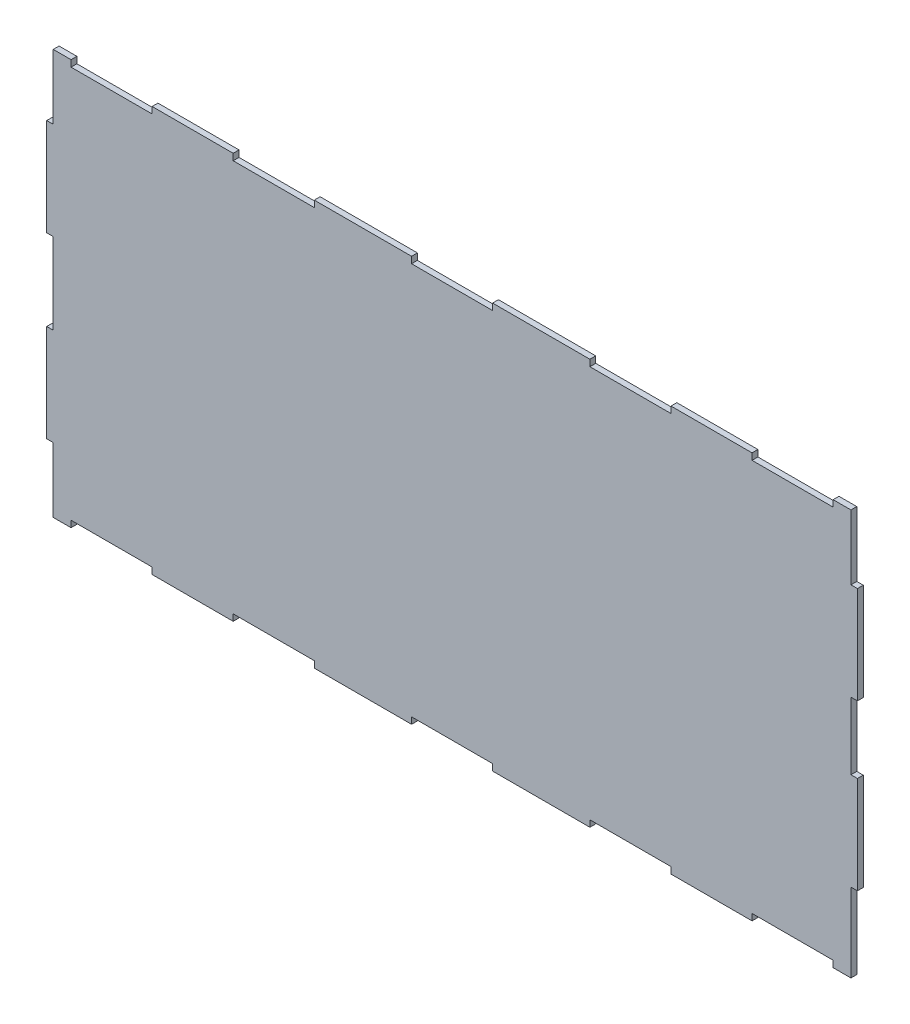
from build123d import *

# Parameters (mm, degrees)
SKETCH_1_W          = 500
SKETCH_1_H          = 250
EXTRUDE_1_DEPTH     = 3.6
SKETCH_2_W          = 50
SKETCH_2_H          = 4
CUT_EXTRUDE_1_DEPTH = 3.6
SKETCH_3_W          = 4
SKETCH_3_H          = 50
SKETCH_3_H_2        = 41.448480175
CUT_EXTRUDE_2_DEPTH = 3.6


with BuildPart() as part:
    # 草图1 → 凸台-拉伸1 (new body)
    with BuildSketch(Plane.XY):
        Rectangle(SKETCH_1_W, SKETCH_1_H)
    extrude(amount=EXTRUDE_1_DEPTH)

    # 草图2 → 切除-拉伸1 (cut)
    with BuildSketch(Plane.XY.offset(3.6)):
        with Locations((0, 123)):
            Rectangle(SKETCH_2_W, SKETCH_2_H)
        with Locations((-110, 123)):
            Rectangle(SKETCH_2_W, SKETCH_2_H)
        with Locations((-210, 123)):
            Rectangle(SKETCH_2_W, SKETCH_2_H)
        with Locations((110, 123)):
            Rectangle(SKETCH_2_W, SKETCH_2_H)
        with Locations((210, 123)):
            Rectangle(SKETCH_2_W, SKETCH_2_H)
        with Locations((210, -123)):
            Rectangle(SKETCH_2_W, SKETCH_2_H)
        with Locations((110, -123)):
            Rectangle(SKETCH_2_W, SKETCH_2_H)
        with Locations((-210, -123)):
            Rectangle(SKETCH_2_W, SKETCH_2_H)
        with Locations((-110, -123)):
            Rectangle(SKETCH_2_W, SKETCH_2_H)
        with Locations((0, -123)):
            Rectangle(SKETCH_2_W, SKETCH_2_H)
    extrude(amount=-CUT_EXTRUDE_1_DEPTH, mode=Mode.SUBTRACT)

    # 草图3 → 切除-拉伸2 (cut)
    with BuildSketch(Plane.XY.offset(3.6)):
        with Locations((-248, 0)):
            Rectangle(SKETCH_3_W, SKETCH_3_H)
        with Locations((-248, 110)):
            Rectangle(SKETCH_3_W, SKETCH_3_H)
        with Locations((-248, -110)):
            Rectangle(SKETCH_3_W, SKETCH_3_H)
        with Locations((248, 4.275759912)):
            Rectangle(SKETCH_3_W, SKETCH_3_H_2)
        with Locations((248, -101.448480175)):
            Rectangle(SKETCH_3_W, SKETCH_3_H)
        with Locations((248, 110)):
            Rectangle(SKETCH_3_W, SKETCH_3_H)
    extrude(amount=-CUT_EXTRUDE_2_DEPTH, mode=Mode.SUBTRACT)


solid = part.part
